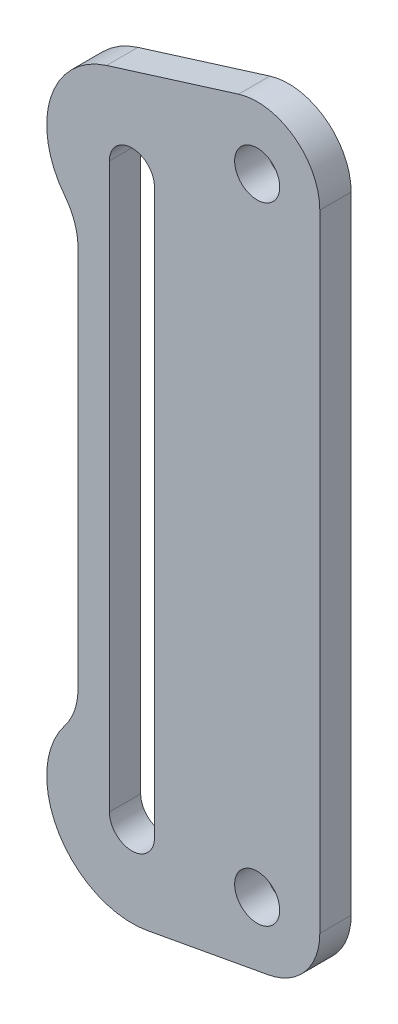
from build123d import *

# Parameters (mm, degrees)
SKETCH1_R           = 2.286
BOSS_EXTRUDE1_DEPTH = 3.175
FILLET1_R           = 6.35


with BuildPart() as part:
    # Sketch1 → Boss-Extrude1 (new body)
    with BuildSketch(Plane.XY):
        with BuildLine():
            Line((-11.14552, -8.494944846), (1.143, -6.246282975))
            ThreePointArc((1.143, -6.246282975), (4.87752755, -4.065983891), (6.35, 0))
            Line((6.35, 0), (6.35, 63.5))
            ThreePointArc((6.35, 63.5), (3.763735435, 68.614371474), (-1.88836081, 69.562721621))
            Line((-1.88836081, 69.562721621), (-15.268170702, 65.395301404))
            ThreePointArc((-15.268170702, 65.395301404), (-21.178428452, 58.792177512), (-18.161, 50.459859867))
            Line((-18.161, 50.459859867), (-18.161, 6.690140133))
            ThreePointArc((-18.161, 6.690140133), (-20.53976569, -3.621956643), (-11.14552, -8.494944846))
        make_face()
        Circle(SKETCH1_R, mode=Mode.SUBTRACT)
        with Locations((0, 63.5)):
            Circle(SKETCH1_R, mode=Mode.SUBTRACT)
        with BuildLine():
            Line((-14.986, 0), (-14.986, 57.15))
            ThreePointArc((-14.986, 57.15), (-12.7, 59.436), (-10.414, 57.15))
            Line((-10.414, 57.15), (-10.414, 0))
            ThreePointArc((-10.414, 0), (-12.7, -2.286), (-14.986, 0))
        make_face(mode=Mode.SUBTRACT)
    extrude(amount=BOSS_EXTRUDE1_DEPTH)

    # Fillet1
    fillet1_edges = [part.edges().sort_by_distance(p)[0] for p in [
        (-18.161, 6.690140133, 1.5875),
        (-18.161, 50.459859867, 1.5875),
    ]]
    fillet(fillet1_edges, radius=FILLET1_R)


solid = part.part
